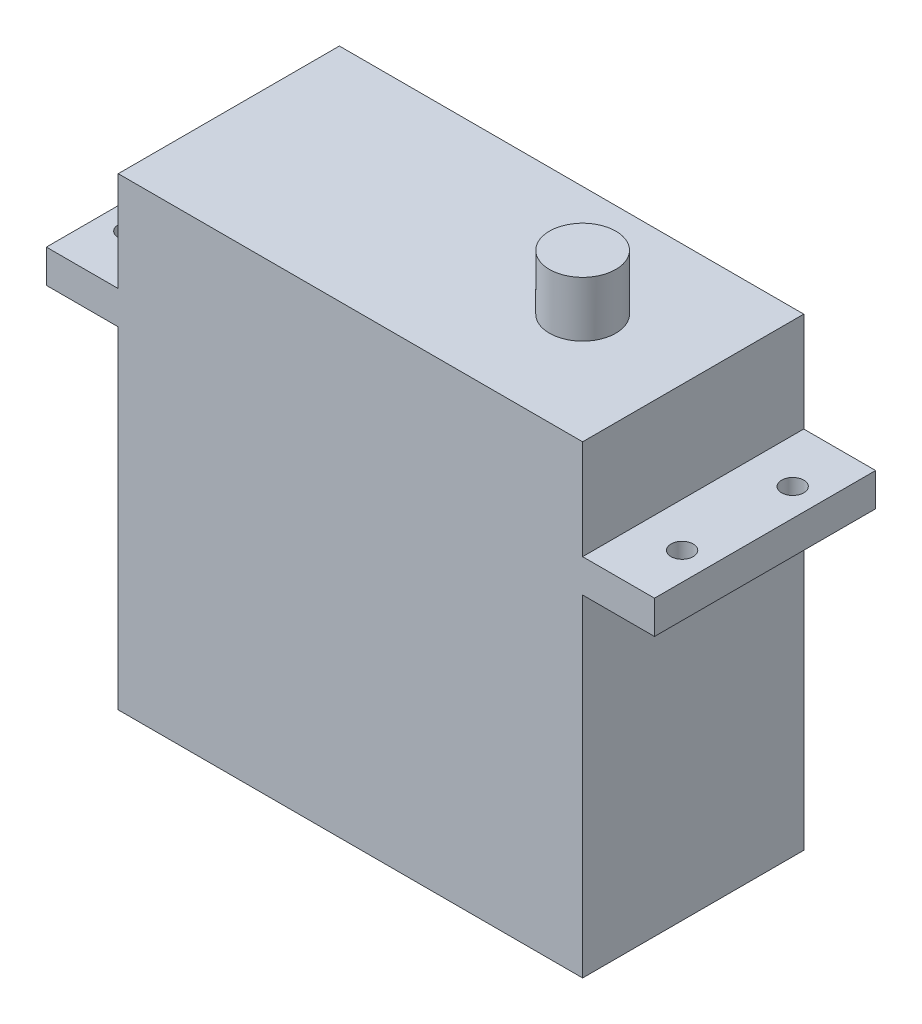
from build123d import *

# Parameters (mm, degrees)
SKETCH1_W           = 42
SKETCH1_H           = 20
BOSS_EXTRUDE1_DEPTH = 42
SKETCH2_W           = 55
SKETCH2_H           = 3
BOSS_EXTRUDE2_DEPTH = 20
SKETCH3_R           = 1
CUT_EXTRUDE1_DEPTH  = 42
SKETCH4_R           = 3
BOSS_EXTRUDE3_DEPTH = 5


with BuildPart() as part:
    # Sketch1 → Boss-Extrude1 (new body)
    with BuildSketch(Plane(origin=(0, 0, 0), x_dir=(1, 0, 0), z_dir=(0, 1, 0))):
        with Locations((21, 10)):
            Rectangle(SKETCH1_W, SKETCH1_H)
    extrude(amount=BOSS_EXTRUDE1_DEPTH)

    # Sketch2 → Boss-Extrude2 (add)
    with BuildSketch(Plane.XY):
        with Locations((21, 31.5)):
            Rectangle(SKETCH2_W, SKETCH2_H)
    extrude(amount=-BOSS_EXTRUDE2_DEPTH)

    # Sketch3 → Cut-Extrude1 (cut)
    with BuildSketch(Plane(origin=(0, 33, 0), x_dir=(1, 0, 0), z_dir=(0, 1, 0))):
        with Locations(Location((-4, 15, 0), (0, 0, 270))):
            Circle(SKETCH3_R)
        with Locations(Location((-4, 5, 0), (0, 0, 270))):
            Circle(SKETCH3_R)
        with Locations(Location((46, 15, 0), (0, 0, 270))):
            Circle(SKETCH3_R)
        with Locations(Location((46, 5, 0), (0, 0, 270))):
            Circle(SKETCH3_R)
    extrude(amount=-CUT_EXTRUDE1_DEPTH, mode=Mode.SUBTRACT)

    # Sketch4 → Boss-Extrude3 (add)
    with BuildSketch(Plane(origin=(0, 42, 0), x_dir=(1, 0, 0), z_dir=(0, 1, 0))):
        with Locations(Location((32, 10, 0), (0, 0, 90))):
            Circle(SKETCH4_R)
    extrude(amount=BOSS_EXTRUDE3_DEPTH)


solid = part.part
